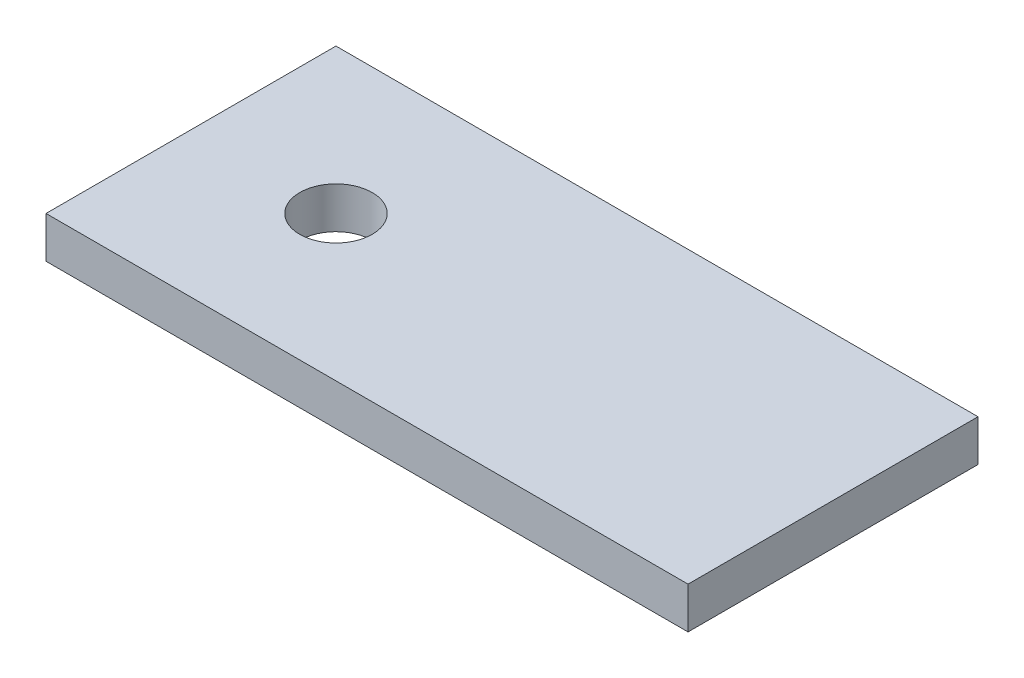
from build123d import *

# Parameters (mm, degrees)
CROQUIS1_W              = 31
CROQUIS1_H              = 14
CROQUIS1_R              = 1.75
SALIENTE_EXTRUIR1_DEPTH = 2


with BuildPart() as part:
    # Croquis1 → Saliente-Extruir1 (new body)
    with BuildSketch(Plane(origin=(0, 0, 0), x_dir=(1, 0, 0), z_dir=(0, 1, 0))):
        with Locations((-15.5, -7)):
            Rectangle(CROQUIS1_W, CROQUIS1_H)
        with Locations(Location((-24, -7, 0), (0, 0, 270))):
            Circle(CROQUIS1_R, mode=Mode.SUBTRACT)
    extrude(amount=SALIENTE_EXTRUIR1_DEPTH)


solid = part.part
